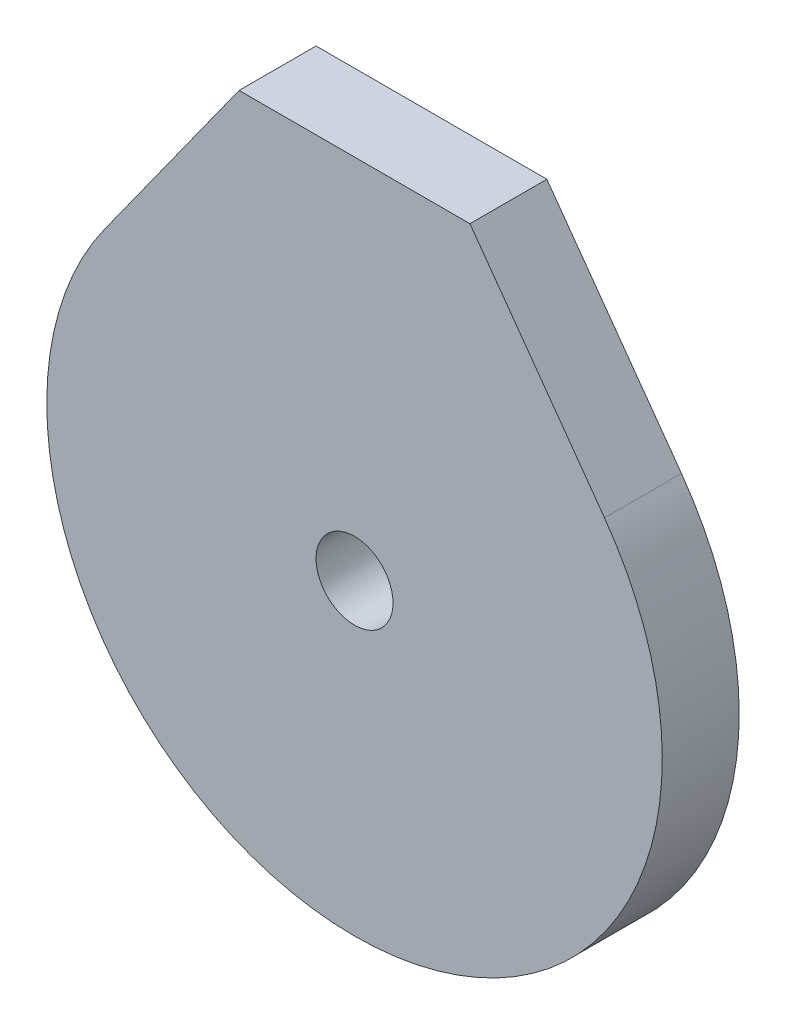
from build123d import *

# Parameters (mm, degrees)
SKETCH1_R           = 5
BOSS_EXTRUDE1_DEPTH = 5


with BuildPart() as part:
    # Sketch1 → Boss-Extrude1 (new, symmetric)
    with BuildSketch(Plane.XY):
        with BuildLine():
            Line((-32.494540834, 23.326054445), (-15, 47.696960071))
            Line((-15, 47.696960071), (15, 47.696960071))
            Line((15, 47.696960071), (32.494540834, 23.326054445))
            ThreePointArc((32.494540834, 23.326054445), (0, -40), (-32.494540834, 23.326054445))
        make_face()
        Circle(SKETCH1_R, mode=Mode.SUBTRACT)
    extrude(amount=BOSS_EXTRUDE1_DEPTH, both=True)


solid = part.part
